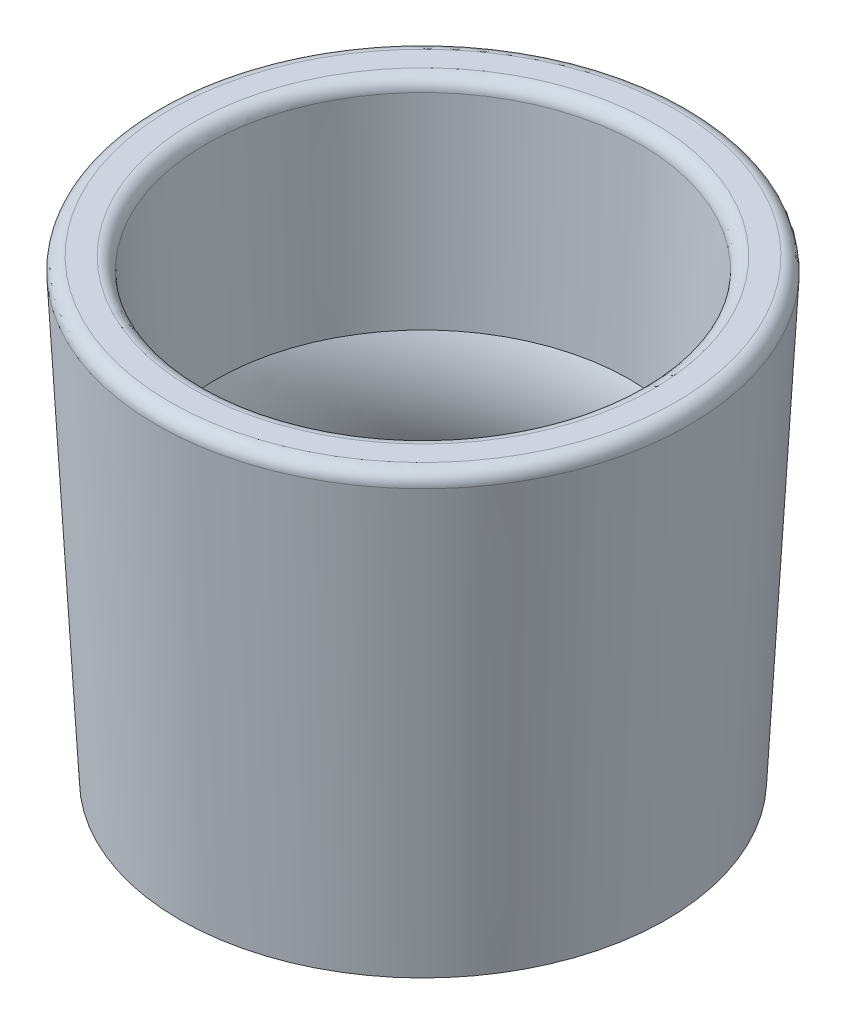
from build123d import *

# Parameters (mm, degrees)
SKIZZE1_R                       = 7.5
AUFSATZ_LINEAR_AUSTRAGEN1_DEPTH = 14
AUFSATZ_LINEAR_AUSTRAGEN1_DRAFT = -3
SKIZZE3_R                       = 0.8
SCHNITT_LINEAR_AUSTRAGEN1_DEPTH = 18.083264466
VERRUNDUNG1_R                   = 0.4


with BuildPart() as part:
    # Skizze1 → Aufsatz-Linear austragen1 (with draft: the straight prism first)
    with BuildSketch(Plane(origin=(0, 0, 0), x_dir=(1, 0, 0), z_dir=(0, 1, 0))):
        Circle(SKIZZE1_R)
    extrude(amount=AUFSATZ_LINEAR_AUSTRAGEN1_DEPTH)
    # Aufsatz-Linear austragen1: the draft: its side faces are tilted about the plane it starts from
    aufsatz_linear_austragen1_sides = [part.faces().sort_by_distance(p)[0] for p in [
        (-7.5, 7, 0),
    ]]
    draft(aufsatz_linear_austragen1_sides, Plane(origin=(0, 0, 0), x_dir=(1, 0, 0), z_dir=(0, 1, 0)), AUFSATZ_LINEAR_AUSTRAGEN1_DRAFT)

    # Skizze2 → Schnitt-Rotation1 (revolve, cut)
    with BuildSketch(Plane.XY, mode=Mode.PRIVATE) as schnitt_rotation1_sk:
        with BuildLine():
            Line((-6.233776488, 4.5), (-6.07655315, 1.5))
            Line((-6.07655315, 1.5), (0, 1.5))
            Line((0, 1.5), (0, 14))
            Line((0, 14), (-6.731650391, 14))
            Line((-6.731650391, 14), (-6.390999826, 7.5))
            ThreePointArc((-6.390999826, 7.5), (-6.020055205, 6.015320521), (-6.233776488, 4.5))
        make_face()
    revolve(schnitt_rotation1_sk.sketch.rotate(Axis((0, 0, 0), (0, 1, 0)), 270), axis=Axis((0, 0, 0), (0, 1, 0)), mode=Mode.SUBTRACT)

    # Skizze3 → Schnitt-Linear austragen1 (cut, through all)
    with BuildSketch(Plane(origin=(0, 1.5, 0), x_dir=(1, 0, 0), z_dir=(0, 1, 0))):
        with Locations(Location((0, 0, 0), (0, 0, 270))):
            Circle(SKIZZE3_R)
    extrude(amount=-SCHNITT_LINEAR_AUSTRAGEN1_DEPTH, mode=Mode.SUBTRACT)

    # Verrundung1
    verrundung1_edges = [part.edges().sort_by_distance(p)[0] for p in [
        (-8.23370891, 14, 0),
        (0, 14, 6.731650391),
    ]]
    fillet(verrundung1_edges, radius=VERRUNDUNG1_R)


solid = part.part
